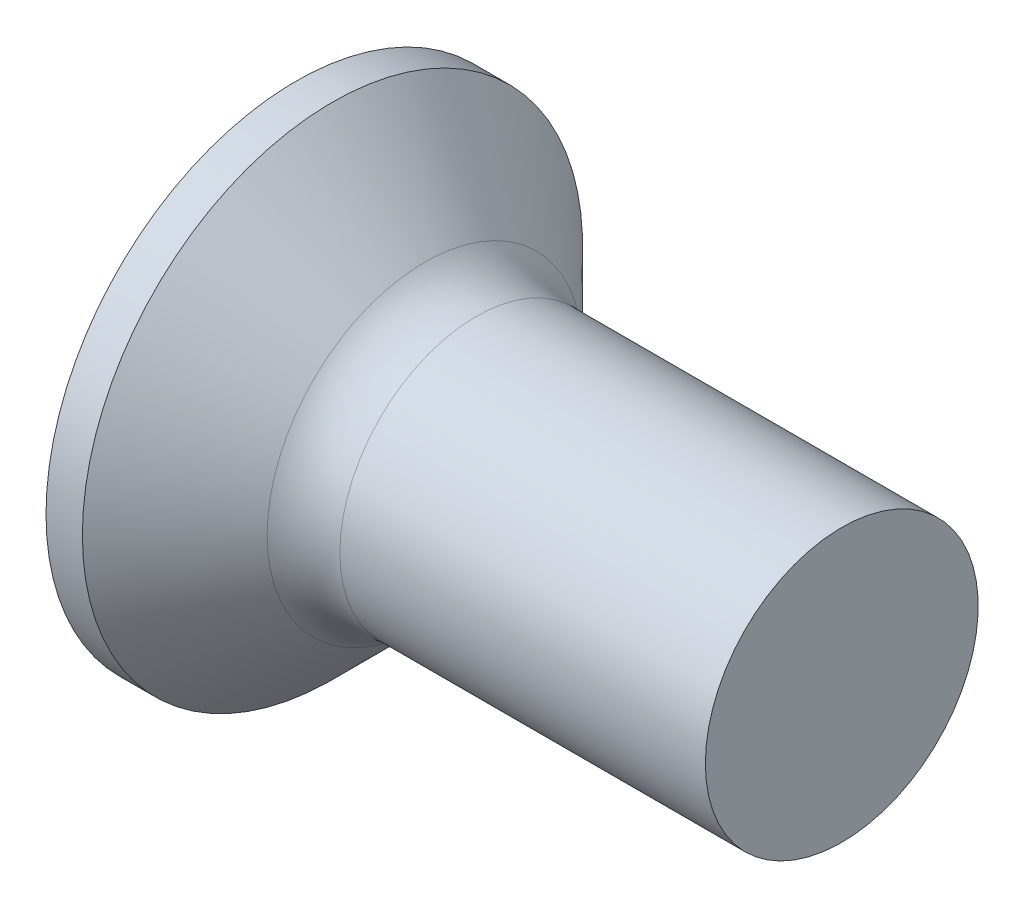
from build123d import *

# Parameters (mm, degrees)
FILLET1_R    = 0.8
RECPAT_COUNT = 2
RECPAT_ANGLE = 90


with BuildPart() as part:
    # BodySke → Base-Revolve (revolve)
    with BuildSketch(Plane.XY, mode=Mode.PRIVATE) as base_revolve_sk:
        with BuildLine():
            Line((0, 0), (6.7, 0))
            Line((6.7, 0), (6.7, 1.5))
            Line((6.7, 1.5), (2.35, 1.5))
            Line((2.35, 1.5), (1.1, 2.75))
            Line((1.1, 2.75), (0.7, 2.75))
            ThreePointArc((0.7, 2.75), (0.177746434, 1.418846362), (0, 0))
        make_face()
    revolve(base_revolve_sk.sketch.rotate(Axis((-15.875, 0, 0), (1, 0, 0)), 90), axis=Axis((-15.875, 0, 0), (1, 0, 0)))

    # Fillet1
    fillet1_edges = [part.edges().sort_by_distance(p)[0] for p in [
        (2.35, 0, -1.5),
    ]]
    fillet(fillet1_edges, radius=FILLET1_R)

    # Sketch3 → Recess section 0
    with BuildSketch(Plane(origin=(0, 0, 0), x_dir=(0, 0, -1), z_dir=(1, 0, 0))):
        with BuildLine():
            Line((0.37, -1.55), (-0.37, -1.55))
            Line((-0.37, -1.55), (-0.37, 1.55))
            Line((-0.37, 1.55), (0.37, 1.55))
            Line((0.37, 1.55), (0.37, -1.55))
        make_face()
    # Sketch4 → Recess section 1
    with BuildSketch(Plane(origin=(2.08, 0, 0), x_dir=(0, 0, -1), z_dir=(1, 0, 0))):
        with BuildLine():
            Line((0.37, -0.512950429), (-0.37, -0.512950429))
            Line((-0.37, -0.512950429), (-0.37, 0.512950429))
            Line((-0.37, 0.512950429), (0.37, 0.512950429))
            Line((0.37, 0.512950429), (0.37, -0.512950429))
        make_face()
    recess = loft(mode=Mode.SUBTRACT)

    # RecPat: Recess ×2 about axis
    recpat_axis = Axis((0, 0, 0), (1, 0, 0))
    for i in range(1, RECPAT_COUNT):
        add(recess.rotate(recpat_axis, i * RECPAT_ANGLE / (RECPAT_COUNT - 1)), mode=Mode.SUBTRACT)

    # RecCorSke → RecessCore (revolve, cut)
    with BuildSketch(Plane.XY, mode=Mode.PRIVATE) as recesscore_sk:
        Polygon((0, 0), (0, 0.701447769), (2.08, 0.556), (2.260655351, 0), align=None)
    revolve(recesscore_sk.sketch.rotate(Axis((-3.175, 0, 0), (1, 0, 0)), 90), axis=Axis((-3.175, 0, 0), (1, 0, 0)), mode=Mode.SUBTRACT)


solid = part.part
